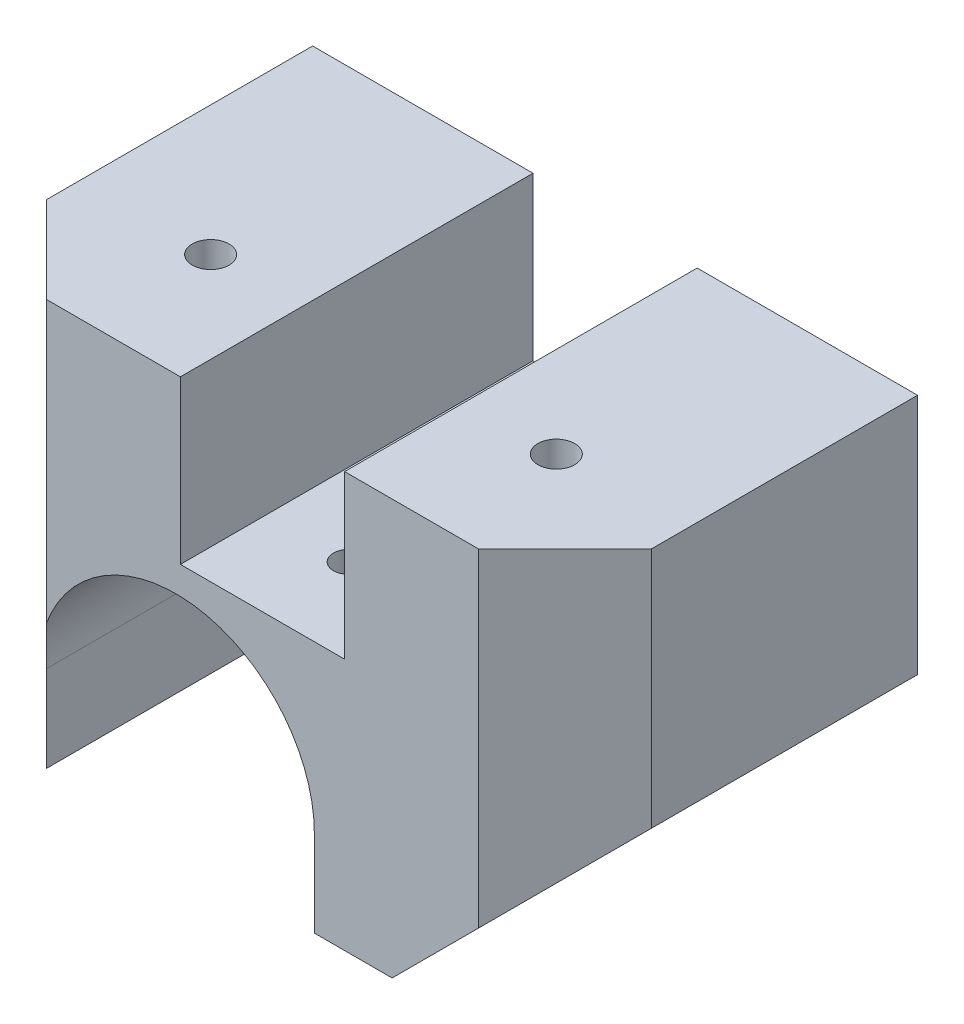
from build123d import *

# Parameters (mm, degrees)
SKETCH1_W                 = 44.45
SKETCH1_H                 = 25.908
BOSS_EXTRUDE1_DEPTH       = 30.48
SIDECHAMFER_SIZE          = 12.7
BACKCHAMFERS_SIZE         = 6.35
SKETCH2_W                 = 12.065
SKETCH2_H                 = 11.938
LINACTSLOT_DEPTH          = 46.762489978
MOUTINGHOLES_D            = 2.7051
MOUTINGHOLES_DEPTH        = 14.478
MOUTINGHOLES_TIP          = 0.81269403
CUT_EXTRUDE1_DEPTH        = 46.762489978
MOTORMOUNTINGHOLES2_D     = 2.2606
MOTORMOUNTINGHOLES2_DEPTH = 11.43
MOTORMOUNTINGHOLES2_TIP   = 0.679152758
GRIPPERSETSCREW_D         = 2.2606


with BuildPart() as part:
    # Sketch1 → Boss-Extrude1 (new body)
    with BuildSketch(Plane(origin=(0, 0, 0), x_dir=(1, 0, 0), z_dir=(0, 1, 0))):
        Rectangle(SKETCH1_W, SKETCH1_H)
    extrude(amount=BOSS_EXTRUDE1_DEPTH)

    # SideChamfer
    sidechamfer_edges = [part.edges().sort_by_distance(p)[0] for p in [
        (22.225, 0, 0),
    ]]
    chamfer(sidechamfer_edges, length=SIDECHAMFER_SIZE)

    # BackChamfers
    backchamfers_edges = [part.edges().sort_by_distance(p)[0] for p in [
        (22.225, 21.59, 12.954),
        (-22.225, 15.24, 12.954),
    ]]
    chamfer(backchamfers_edges, length=BACKCHAMFERS_SIZE)

    # Sketch2 → LinActSlot (cut, through all)
    with BuildSketch(Plane.XY.offset(12.954)):
        with Locations((0, 24.511)):
            Rectangle(SKETCH2_W, SKETCH2_H)
    extrude(amount=-LINACTSLOT_DEPTH, mode=Mode.SUBTRACT)

    # MoutingHoles
    with Locations(Plane(origin=(14.160350453, 30.48, 8.373414988), x_dir=(-1, 0, 0), z_dir=(0, 1, 0))):
        with Locations((1.460350453, -4.309414988), (26.860350453, -4.309414988)):
            Hole(MOUTINGHOLES_D / 2, depth=MOUTINGHOLES_DEPTH)
            with Locations((0, 0, -(MOUTINGHOLES_DEPTH + MOUTINGHOLES_TIP / 2))):  # 118° drill point
                Cone(0, MOUTINGHOLES_D / 2, MOUTINGHOLES_TIP, mode=Mode.SUBTRACT)

    # Sketch11 → Cut-Extrude1 (cut, through all)
    with BuildSketch(Plane(origin=(0, 0, -12.954), x_dir=(-1, 0, 0), z_dir=(0, 0, -1))):
        with BuildLine():
            Line((16.51, 6.35), (16.51, 0))
            Line((16.51, 0), (-3.81, 0))
            Line((-3.81, 0), (-3.81, 6.35))
            ThreePointArc((-3.81, 6.35), (6.35, 16.51), (16.51, 6.35))
        make_face()
    extrude(amount=-CUT_EXTRUDE1_DEPTH, mode=Mode.SUBTRACT)

    # MotorMountingHoles2
    with Locations(Plane(origin=(0, 0, -12.954), x_dir=(-1, 0, 0), z_dir=(0, 0, -1))):
        with Locations((18.8468, 6.35), (-6.1468, 6.35)):
            Hole(MOTORMOUNTINGHOLES2_D / 2, depth=MOTORMOUNTINGHOLES2_DEPTH)
            with Locations((0, 0, -(MOTORMOUNTINGHOLES2_DEPTH + MOTORMOUNTINGHOLES2_TIP / 2))):  # 118° drill point
                Cone(0, MOTORMOUNTINGHOLES2_D / 2, MOTORMOUNTINGHOLES2_TIP, mode=Mode.SUBTRACT)

    # GripperSetScrew (through all)
    with Locations(Plane(origin=(0, 18.542, 0), x_dir=(1, 0, 0), z_dir=(0, 1, 0))):
        with Locations((0, -6.604)):
            Hole(GRIPPERSETSCREW_D / 2)


solid = part.part
